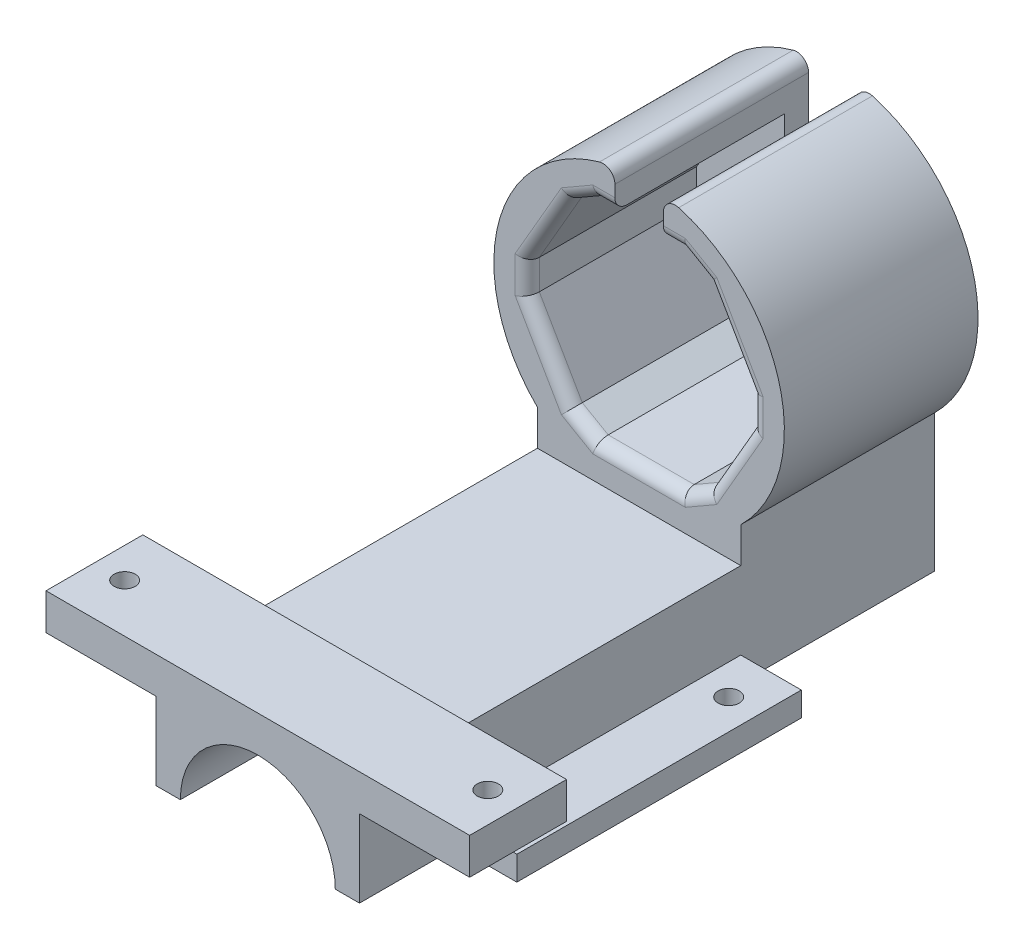
from build123d import *

# Parameters (mm, degrees)
BOSS_EXTRUDE1_DEPTH      = 95
BOSS_EXTRUDE2_DEPTH      = 32
SKETCH3_W                = 10
SKETCH3_H                = 16
SKETCH3_H_2              = 32
CUT_EXTRUDE1_DEPTH       = 4
CUT_EXTRUDE2_DEPTH       = 28
BOSS_EXTRUDE3_DEPTH      = 2
BOSS_EXTRUDE3_DEPTH_BACK = 4
SKETCH5_W                = 70
SKETCH5_H                = 16
SKETCH6_R                = 1.75
CUT_EXTRUDE3_DEPTH       = 111.792599031
SKETCH7_R                = 1.75
CUT_EXTRUDE4_DEPTH       = 118.58418261
CUT_EXTRUDE5_DEPTH       = 117.517981445
CUT_EXTRUDE5_DEPTH_BACK  = 117.517981445
FILLET1_R                = 2


with BuildPart() as part:
    # Sketch1 → Boss-Extrude1 (new body)
    with BuildSketch(Plane(origin=(0, 0, 0), x_dir=(0, 1, 0), z_dir=(0, 0, 1))):
        with BuildLine():
            Line((16.8, -16.8), (16.8, 16.8))
            Line((16.8, 16.8), (4, 16.8))
            Line((4, 16.8), (4, 26.8))
            Line((4, 26.8), (0, 26.8))
            Line((0, 26.8), (0, 12.8))
            ThreePointArc((0, 12.8), (12.8, 0), (0, -12.8))
            Line((0, -12.8), (0, -26.8))
            Line((0, -26.8), (4, -26.8))
            Line((4, -26.8), (4, -16.8))
            Line((4, -16.8), (16.8, -16.8))
        make_face()
    extrude(amount=BOSS_EXTRUDE1_DEPTH)

    # Sketch2 → Boss-Extrude2 (add)
    with BuildSketch(Plane(origin=(0, 0, 0), x_dir=(1, 0, 0), z_dir=(0, 0, -1))):
        with BuildLine():
            Line((-16.8, -16.8), (-16.8, -22.660571771))
            ThreePointArc((-16.8, -22.660571771), (0, -63.8), (16.8, -22.660571771))
            Line((16.8, -22.660571771), (16.8, -16.8))
            Line((16.8, -16.8), (-16.8, -16.8))
        make_face()
    extrude(amount=-BOSS_EXTRUDE2_DEPTH)

    # Sketch3 → Cut-Extrude1 (cut)
    with BuildSketch(Plane.XZ):
        with Locations((-21.8, 87)):
            Rectangle(SKETCH3_W, SKETCH3_H)
        with Locations((-21.8, 16)):
            Rectangle(SKETCH3_W, SKETCH3_H_2)
        with Locations((21.8, 16)):
            Rectangle(SKETCH3_W, SKETCH3_H_2)
        with Locations((21.8, 87)):
            Rectangle(SKETCH3_W, SKETCH3_H)
    extrude(amount=-CUT_EXTRUDE1_DEPTH, mode=Mode.SUBTRACT)

    # Sketch4 → Cut-Extrude2 (cut)
    with BuildSketch(Plane.XY.offset(32)):
        Polygon((-11.38, 54.574393389), (-18.485, 42.268172401), (-18.485, 37.331827599), (-11.38, 25.025606611), (-7.105, 22.557434211), (7.105, 22.557434211), (11.38, 25.025606611), (18.485, 37.331827599), (18.485, 42.268172401), (11.38, 54.574393389), (7.105, 57.042565789), (-7.105, 57.042565789), align=None)
    extrude(amount=-CUT_EXTRUDE2_DEPTH, mode=Mode.SUBTRACT)

    # Sketch5 → Boss-Extrude3 (add, two sides: drawn at the far end of the back side and taken through both)
    with BuildSketch(Plane(origin=(0, 16.8, 0), x_dir=(-1, 0, 0), z_dir=(0, 1, 0)).offset(-BOSS_EXTRUDE3_DEPTH_BACK)):
        with Locations((0, 87)):
            Rectangle(SKETCH5_W, SKETCH5_H)
    extrude(amount=BOSS_EXTRUDE3_DEPTH + BOSS_EXTRUDE3_DEPTH_BACK)

    # Sketch6 → Cut-Extrude3 (cut, through all)
    with BuildSketch(Plane(origin=(0, 18.8, 0), x_dir=(-1, 0, 0), z_dir=(0, 1, 0))):
        with Locations(Location((-30, 87, 0), (0, 0, 90))):
            Circle(SKETCH6_R)
        with Locations(Location((30, 87, 0), (0, 0, 90))):
            Circle(SKETCH6_R)
    extrude(amount=-CUT_EXTRUDE3_DEPTH, mode=Mode.SUBTRACT)

    # Sketch7 → Cut-Extrude4 (cut, through all)
    with BuildSketch(Plane(origin=(0, 4, 0), x_dir=(-1, 0, 0), z_dir=(0, 1, 0))):
        with Locations(Location((-21.8, 72, 0), (0, 0, 90))):
            Circle(SKETCH7_R)
        with Locations(Location((-21.8, 39, 0), (0, 0, 90))):
            Circle(SKETCH7_R)
        with Locations(Location((21.8, 39, 0), (0, 0, 270))):
            Circle(SKETCH7_R)
        with Locations(Location((21.8, 72, 0), (0, 0, 270))):
            Circle(SKETCH7_R)
    extrude(amount=-CUT_EXTRUDE4_DEPTH, mode=Mode.SUBTRACT)

    # Sketch8 → Cut-Extrude5 (cut, two sides: drawn at the far end of the back side and taken through both)
    with BuildSketch(Plane.XY.offset(4).offset(-CUT_EXTRUDE5_DEPTH_BACK)):
        with BuildLine():
            Line((-4, 35.8), (4, 35.8))
            Line((4, 35.8), (4, 63.464319132))
            ThreePointArc((4, 63.464319132), (0, 63.8), (-4, 63.464319132))
            Line((-4, 63.464319132), (-4, 35.8))
        make_face()
    extrude(amount=CUT_EXTRUDE5_DEPTH + CUT_EXTRUDE5_DEPTH_BACK, mode=Mode.SUBTRACT)

    # Fillet1
    fillet1_edges = [part.edges().sort_by_distance(p)[0] for p in [
        (-9.2425, 55.808479589, 32),
        (-14.9325, 48.421282895, 32),
        (-18.485, 39.8, 32),
        (-14.9325, 31.178717105, 32),
        (-9.2425, 23.791520411, 32),
        (0, 22.557434211, 32),
        (9.2425, 23.791520411, 32),
        (14.9325, 31.178717105, 32),
        (18.485, 39.8, 32),
        (14.9325, 48.421282895, 32),
        (9.2425, 55.808479589, 32),
        (5.5525, 57.042565789, 32),
        (-5.5525, 57.042565789, 32),
        (-4, 63.464319132, 16),
        (4, 63.464319132, 16),
    ]]
    fillet(fillet1_edges, radius=FILLET1_R)


solid = part.part
